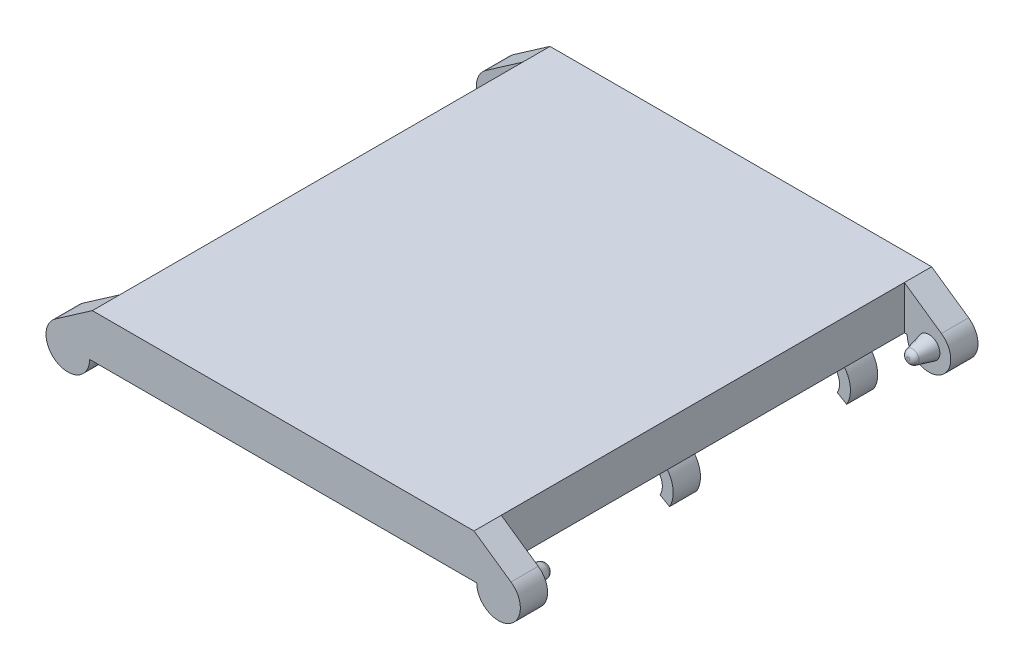
from build123d import *

# Parameters (mm, degrees)
SKETCH1_W           = 70
SKETCH1_H           = 83.94
BOSS_EXTRUDE1_DEPTH = 8
BOSS_EXTRUDE2_START = -10
SKETCH3_R           = 5.1
SKETCH3_R_2         = 3.1
BOSS_EXTRUDE2_DEPTH = 5
CUT_EXTRUDE1_DEPTH  = 63
BOSS_EXTRUDE3_DEPTH = 5
SKETCH6_R           = 2
BOSS_EXTRUDE4_DEPTH = 3.8
BOSS_EXTRUDE4_TAPER = 14
FILLET1_R           = 1


with BuildPart() as part:
    # Sketch1 → Boss-Extrude1 (new body)
    with BuildSketch(Plane(origin=(0, 0, 0), x_dir=(1, 0, 0), z_dir=(0, 1, 0))):
        Rectangle(SKETCH1_W, SKETCH1_H)
    extrude(amount=BOSS_EXTRUDE1_DEPTH)

    # Sketch3 → Boss-Extrude2 (add)
    # profile 1 of 2: a face of its own
    with BuildSketch(Plane(origin=(0, 0, -41.97), x_dir=(-1, 0, 0), z_dir=(0, 0, -1)).offset(BOSS_EXTRUDE2_START)):
        with Locations((-30, -4.1)):
            Circle(SKETCH3_R)
        with Locations((-30, -4.1)):
            Circle(SKETCH3_R_2, mode=Mode.SUBTRACT)
    # profile 2 of 2: a face of its own
    with BuildSketch(Plane(origin=(0, 0, -41.97), x_dir=(-1, 0, 0), z_dir=(0, 0, -1)).offset(BOSS_EXTRUDE2_START)):
        with Locations((30, -4.1)):
            Circle(SKETCH3_R)
        with Locations((30, -4.1)):
            Circle(SKETCH3_R_2, mode=Mode.SUBTRACT)
    boss_extrude2 = extrude(amount=-BOSS_EXTRUDE2_DEPTH)

    # Mirror1: Boss-Extrude2 across plane
    add(boss_extrude2.mirror(Plane.XY.offset(-13.22)))

    # Sketch4 → Cut-Extrude1 (cut)
    with BuildSketch(Plane.XY.offset(5.53)):
        Polygon((30, -4.1), (40, -9.873502692), (20, -9.873502692), align=None)
        Polygon((-40, -9.873502692), (-20, -9.873502692), (-30, -4.1), align=None)
    extrude(amount=-CUT_EXTRUDE1_DEPTH, mode=Mode.SUBTRACT)


with BuildPart() as body_2:
    # Sketch5 → Boss-Extrude3 (new body)
    with BuildSketch(Plane.XY.offset(41.97)):
        with BuildLine():
            Line((35, 8), (35.5, 8))
            ThreePointArc((35.5, 8), (41.352973318, 11.544924524), (41.783244941, 4.715674721))
            Line((41.783244941, 4.715674721), (35, 0))
            Line((35, 0), (35, 8))
        make_face()
    extrude(amount=-BOSS_EXTRUDE3_DEPTH)

    # Sketch6 → Boss-Extrude4 (add)
    with BuildSketch(Plane(origin=(0, 0, 36.97), x_dir=(-1, 0, 0), z_dir=(0, 0, -1))):
        with Locations((-39.5, 8)):
            Circle(SKETCH6_R)
    extrude(amount=BOSS_EXTRUDE4_DEPTH, taper=BOSS_EXTRUDE4_TAPER)

    # Fillet1
    fillet1_edges = [body_2.edges().sort_by_distance(p)[0] for p in [
        (40.552553589, 8, 33.17),
    ]]
    fillet(fillet1_edges, radius=FILLET1_R)


with BuildPart() as body_3:
    # Mirror2: mirrored copy
    add(body_2.part.mirror(Plane(origin=(0, 4, 0), x_dir=(0, 0, 1), z_dir=(0, -1, 0))))


with BuildPart() as body_3_2:
    # Mirror3: mirrored copy
    add(body_3.part.mirror(Plane.XY))


with BuildPart() as body_4:
    # Mirror4: mirrored copy
    add(body_3.part.mirror(Plane.ZY))


with BuildPart() as body_5:
    # Mirror4 2: mirrored copy
    add(body_3_2.part.mirror(Plane.ZY))

    # Combine1: union part, body 4, body 3, body 3 2
    add(part.part)
    add(body_4.part)
    add(body_3.part)
    add(body_3_2.part)


solid = body_5.part
